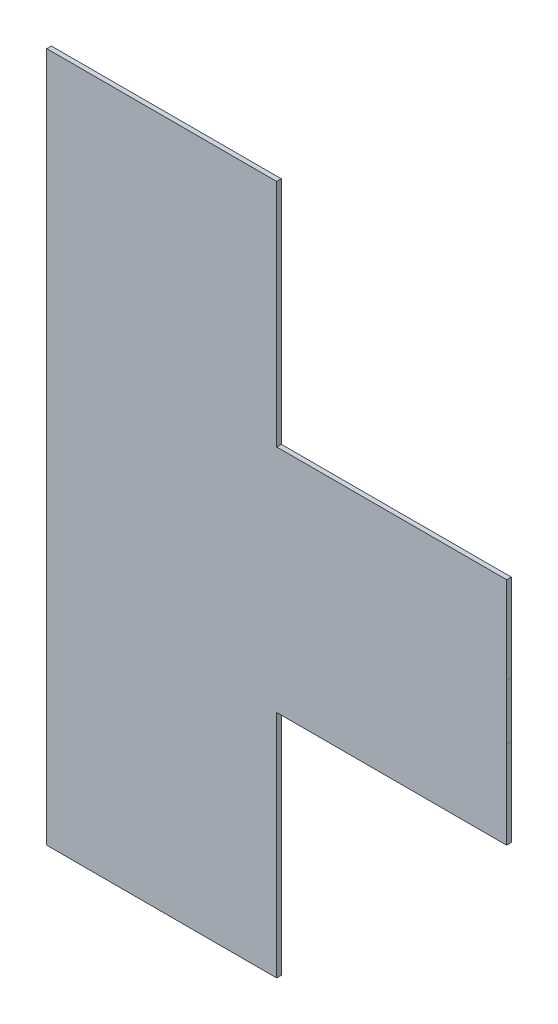
from build123d import *

# Parameters (mm, degrees)
BOSS_EXTRUDE1_DEPTH = 1


with BuildPart() as part:
    # Sketch1 → Boss-Extrude1 (new body)
    with BuildSketch(Plane.XY):
        Polygon((50, 100), (50, 150), (0, 150), (0, 0), (50, 0), (50, 50), (100, 50), (100, 100), align=None)
    extrude(amount=BOSS_EXTRUDE1_DEPTH)


solid = part.part
